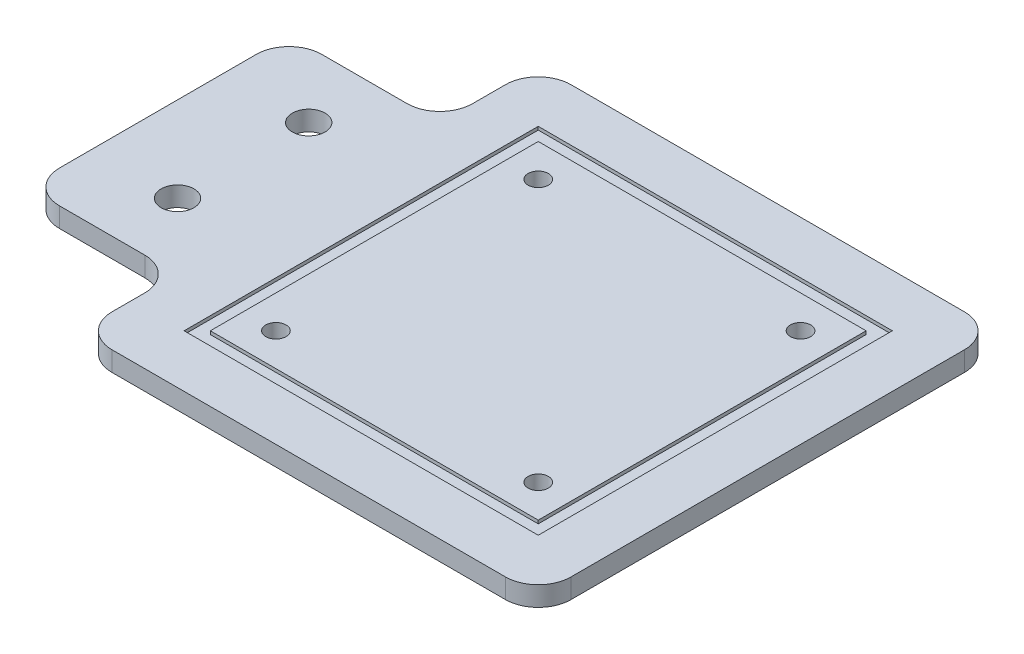
from build123d import *

# Parameters (mm, degrees)
BOSS_EXTRUDE1_DEPTH = 40
CUT_EXTRUDE1_REACH  = 53.556
SKETCH2_R           = 2.5
CUT_EXTRUDE2_REACH  = 53.556
SKETCH3_R           = 2.5
SKETCH4_W           = 70
SKETCH4_H           = 70
BOSS_EXTRUDE2_DEPTH = 3
SKETCH8_W           = 54
SKETCH8_H           = 54
SKETCH8_W_2         = 50
SKETCH8_H_2         = 50
CUT_EXTRUDE7_DEPTH  = 0.5
CUT_EXTRUDE8_REACH  = 112.467
SKETCH9_R           = 1.55
CUT_EXTRUDE9_REACH  = 112.467
SKETCH10_W          = 40
SKETCH10_H          = 20
FILLET1_R           = 5


with BuildPart() as part:
    # Sketch1 → Boss-Extrude1 (new body)
    with BuildSketch(Plane.XY):
        Polygon((0, 0), (0, 23), (23, 23), (23, 20), (3, 20), (3, 0), align=None)
    extrude(amount=BOSS_EXTRUDE1_DEPTH)

    # Sketch2 → Cut-Extrude1 (cut, up to next)
    with BuildSketch(Plane(origin=(0, 23, 0), x_dir=(1, 0, 0), z_dir=(0, 1, 0)), mode=Mode.PRIVATE) as cut_extrude1_sk1:
        with Locations(Location((13, -10, 0), (0, 0, 270))):
            Circle(SKETCH2_R)
    cut_extrude1_tool1 = extrude(cut_extrude1_sk1.sketch, amount=-CUT_EXTRUDE1_REACH, mode=Mode.PRIVATE) & part.part
    # Sketch2 → Cut-Extrude1 (cut, up to next)
    with BuildSketch(Plane(origin=(0, 23, 0), x_dir=(1, 0, 0), z_dir=(0, 1, 0)), mode=Mode.PRIVATE) as cut_extrude1_sk2:
        with Locations(Location((13, -30, 0), (0, 0, 270))):
            Circle(SKETCH2_R)
    cut_extrude1_tool2 = extrude(cut_extrude1_sk2.sketch, amount=-CUT_EXTRUDE1_REACH, mode=Mode.PRIVATE) & part.part
    add(cut_extrude1_tool1.solids().sort_by_distance((13, 23, 10))[0], mode=Mode.SUBTRACT)
    add(cut_extrude1_tool2.solids().sort_by_distance((13, 23, 30))[0], mode=Mode.SUBTRACT)

    # Sketch3 → Cut-Extrude2 (cut, up to next)
    with BuildSketch(Plane.ZY, mode=Mode.PRIVATE) as cut_extrude2_sk1:
        with Locations((10, 10)):
            Circle(SKETCH3_R)
    cut_extrude2_tool1 = extrude(cut_extrude2_sk1.sketch, amount=-CUT_EXTRUDE2_REACH, mode=Mode.PRIVATE) & part.part
    # Sketch3 → Cut-Extrude2 (cut, up to next)
    with BuildSketch(Plane.ZY, mode=Mode.PRIVATE) as cut_extrude2_sk2:
        with Locations((30, 10)):
            Circle(SKETCH3_R)
    cut_extrude2_tool2 = extrude(cut_extrude2_sk2.sketch, amount=-CUT_EXTRUDE2_REACH, mode=Mode.PRIVATE) & part.part
    add(cut_extrude2_tool1.solids().sort_by_distance((0, 10, 10))[0], mode=Mode.SUBTRACT)
    add(cut_extrude2_tool2.solids().sort_by_distance((0, 10, 30))[0], mode=Mode.SUBTRACT)

    # Sketch4 → Boss-Extrude2 (add)
    with BuildSketch(Plane(origin=(0, 23, 0), x_dir=(1, 0, 0), z_dir=(0, 1, 0))):
        with Locations((58, -20)):
            Rectangle(SKETCH4_W, SKETCH4_H)
    extrude(amount=-BOSS_EXTRUDE2_DEPTH)

    # Sketch8 → Cut-Extrude7 (cut)
    with BuildSketch(Plane(origin=(0, 23, 0), x_dir=(1, 0, 0), z_dir=(0, 1, 0))):
        with Locations((58, -20)):
            Rectangle(SKETCH8_W, SKETCH8_H)
        with Locations((58, -20)):
            Rectangle(SKETCH8_W_2, SKETCH8_H_2, mode=Mode.SUBTRACT)
    extrude(amount=-CUT_EXTRUDE7_DEPTH, mode=Mode.SUBTRACT)

    # Sketch9 → Cut-Extrude8 (cut, up to next)
    with BuildSketch(Plane(origin=(0, 23, 0), x_dir=(1, 0, 0), z_dir=(0, 1, 0)), mode=Mode.PRIVATE) as cut_extrude8_sk1:
        with Locations(Location((38, -40, 0), (0, 0, 270))):
            Circle(SKETCH9_R)
    cut_extrude8_tool1 = extrude(cut_extrude8_sk1.sketch, amount=-CUT_EXTRUDE8_REACH, mode=Mode.PRIVATE) & part.part
    # Sketch9 → Cut-Extrude8 (cut, up to next)
    with BuildSketch(Plane(origin=(0, 23, 0), x_dir=(1, 0, 0), z_dir=(0, 1, 0)), mode=Mode.PRIVATE) as cut_extrude8_sk2:
        with Locations(Location((38, 0, 0), (0, 0, 270))):
            Circle(SKETCH9_R)
    cut_extrude8_tool2 = extrude(cut_extrude8_sk2.sketch, amount=-CUT_EXTRUDE8_REACH, mode=Mode.PRIVATE) & part.part
    # Sketch9 → Cut-Extrude8 (cut, up to next)
    with BuildSketch(Plane(origin=(0, 23, 0), x_dir=(1, 0, 0), z_dir=(0, 1, 0)), mode=Mode.PRIVATE) as cut_extrude8_sk3:
        with Locations(Location((78, 0, 0), (0, 0, 270))):
            Circle(SKETCH9_R)
    cut_extrude8_tool3 = extrude(cut_extrude8_sk3.sketch, amount=-CUT_EXTRUDE8_REACH, mode=Mode.PRIVATE) & part.part
    # Sketch9 → Cut-Extrude8 (cut, up to next)
    with BuildSketch(Plane(origin=(0, 23, 0), x_dir=(1, 0, 0), z_dir=(0, 1, 0)), mode=Mode.PRIVATE) as cut_extrude8_sk4:
        with Locations(Location((78, -40, 0), (0, 0, 270))):
            Circle(SKETCH9_R)
    cut_extrude8_tool4 = extrude(cut_extrude8_sk4.sketch, amount=-CUT_EXTRUDE8_REACH, mode=Mode.PRIVATE) & part.part
    add(cut_extrude8_tool1.solids().sort_by_distance((38, 23, 40))[0], mode=Mode.SUBTRACT)
    add(cut_extrude8_tool2.solids().sort_by_distance((38, 23, 0))[0], mode=Mode.SUBTRACT)
    add(cut_extrude8_tool3.solids().sort_by_distance((78, 23, 0))[0], mode=Mode.SUBTRACT)
    add(cut_extrude8_tool4.solids().sort_by_distance((78, 23, 40))[0], mode=Mode.SUBTRACT)

    # Sketch10 → Cut-Extrude9 (cut, up to next)
    with BuildSketch(Plane.ZY, mode=Mode.PRIVATE) as cut_extrude9_sk1:
        with Locations((20, 10)):
            Rectangle(SKETCH10_W, SKETCH10_H)
    cut_extrude9_tool1 = extrude(cut_extrude9_sk1.sketch, amount=-CUT_EXTRUDE9_REACH, mode=Mode.PRIVATE) & part.part
    add(cut_extrude9_tool1.solids().sort_by_distance((0, 10, 20))[0], mode=Mode.SUBTRACT)

    # Fillet1
    fillet1_edges = [part.edges().sort_by_distance(p)[0] for p in [
        (23, 21.5, 40),
        (0, 21.5, 40),
        (23, 21.5, 55),
        (23, 21.5, -15),
        (93, 21.5, -15),
        (93, 21.5, 55),
        (0, 21.5, 0),
        (23, 21.5, 0),
    ]]
    fillet(fillet1_edges, radius=FILLET1_R)


solid = part.part
